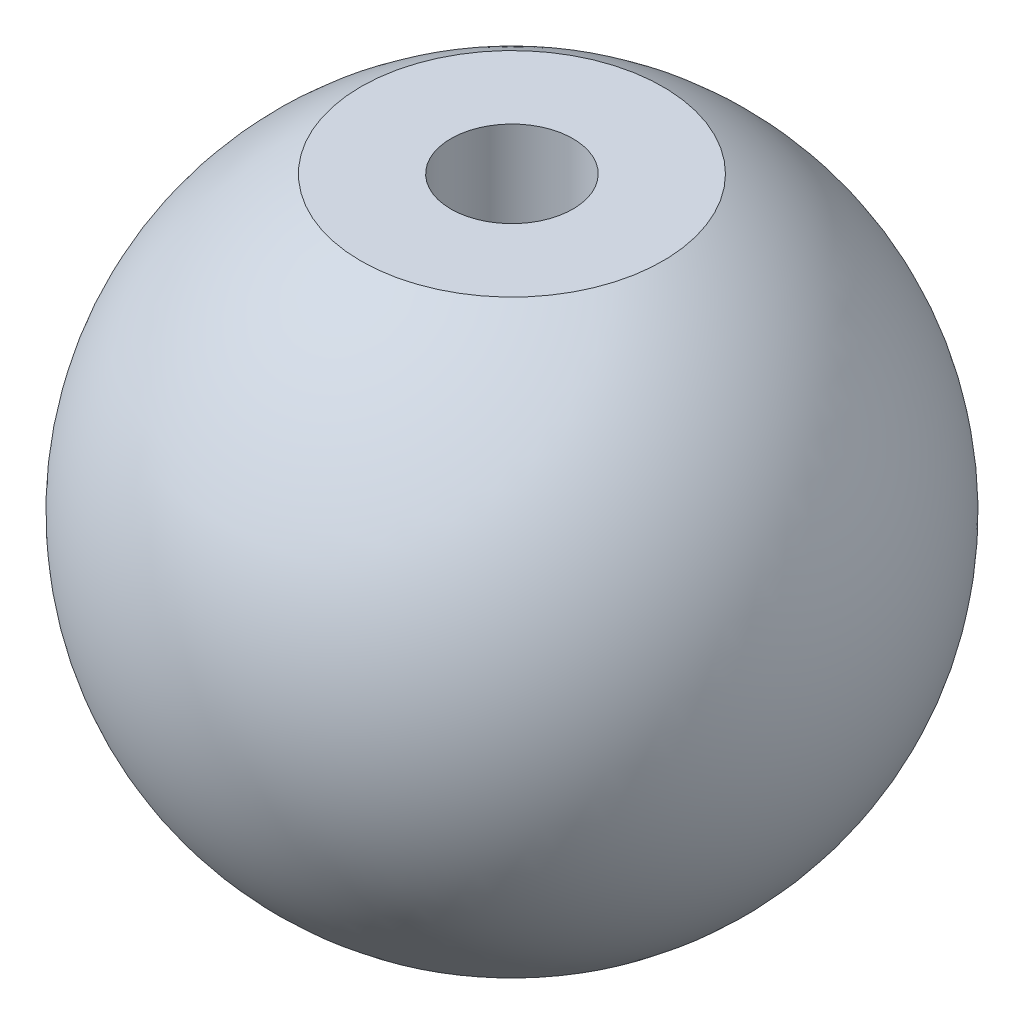
from build123d import *

# Parameters (mm, degrees)
SKETCH_2_R             = 15.938729937
CUT_EXTRUDE_1_DEPTH    = 10
HOLE_WIZARD_M6_1_D     = 5
HOLE_WIZARD_M6_1_DEPTH = 15
HOLE_WIZARD_M6_1_TIP   = 1.502151548


with BuildPart() as part:
    # 草图1 → 旋转1 (revolve)
    with BuildSketch(Plane.XY):
        with BuildLine():
            Line((0, 13.5), (0, -13.5))
            ThreePointArc((0, -13.5), (13.5, 0), (0, 13.5))
        make_face()
    revolve(axis=Axis((0, 0, 0), (0, 1, 0)))

    # 草图2 → 切除-拉伸1 (cut)
    with BuildSketch(Plane(origin=(0, 12, 0), x_dir=(-1, 0, 0), z_dir=(0, 1, 0))):
        Circle(SKETCH_2_R)
    extrude(amount=CUT_EXTRUDE_1_DEPTH, mode=Mode.SUBTRACT)

    # M6 螺纹孔1
    with Locations(Plane(origin=(0, 12, 0), x_dir=(-1, 0, 0), z_dir=(0, 1, 0))):
        with Locations((0, 0)):
            Hole(HOLE_WIZARD_M6_1_D / 2, depth=HOLE_WIZARD_M6_1_DEPTH)
            with Locations((0, 0, -(HOLE_WIZARD_M6_1_DEPTH + HOLE_WIZARD_M6_1_TIP / 2))):  # 118° drill point
                Cone(0, HOLE_WIZARD_M6_1_D / 2, HOLE_WIZARD_M6_1_TIP, mode=Mode.SUBTRACT)


solid = part.part
